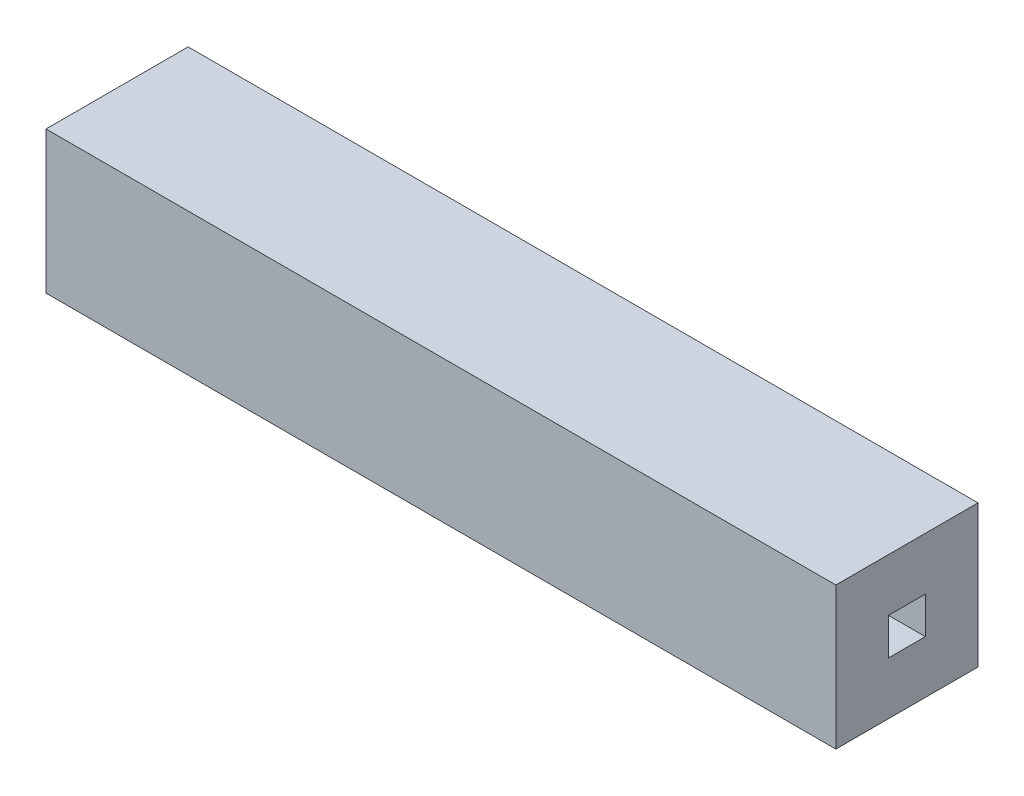
from build123d import *

# Parameters (mm, degrees)
SKETCH1_W           = 2.7
SKETCH1_H           = 2.7
SKETCH1_W_2         = 0.7
SKETCH1_H_2         = 0.7
BOSS_EXTRUDE1_DEPTH = 15


with BuildPart() as part:
    # Sketch1 → Boss-Extrude1 (new body)
    with BuildSketch(Plane(origin=(0, 0, 0), x_dir=(0, 0, -1), z_dir=(1, 0, 0))):
        with Locations((1.35, 1.35)):
            Rectangle(SKETCH1_W, SKETCH1_H)
        with Locations((1.35, 1.35)):
            Rectangle(SKETCH1_W_2, SKETCH1_H_2, mode=Mode.SUBTRACT)
    extrude(amount=BOSS_EXTRUDE1_DEPTH)


solid = part.part
